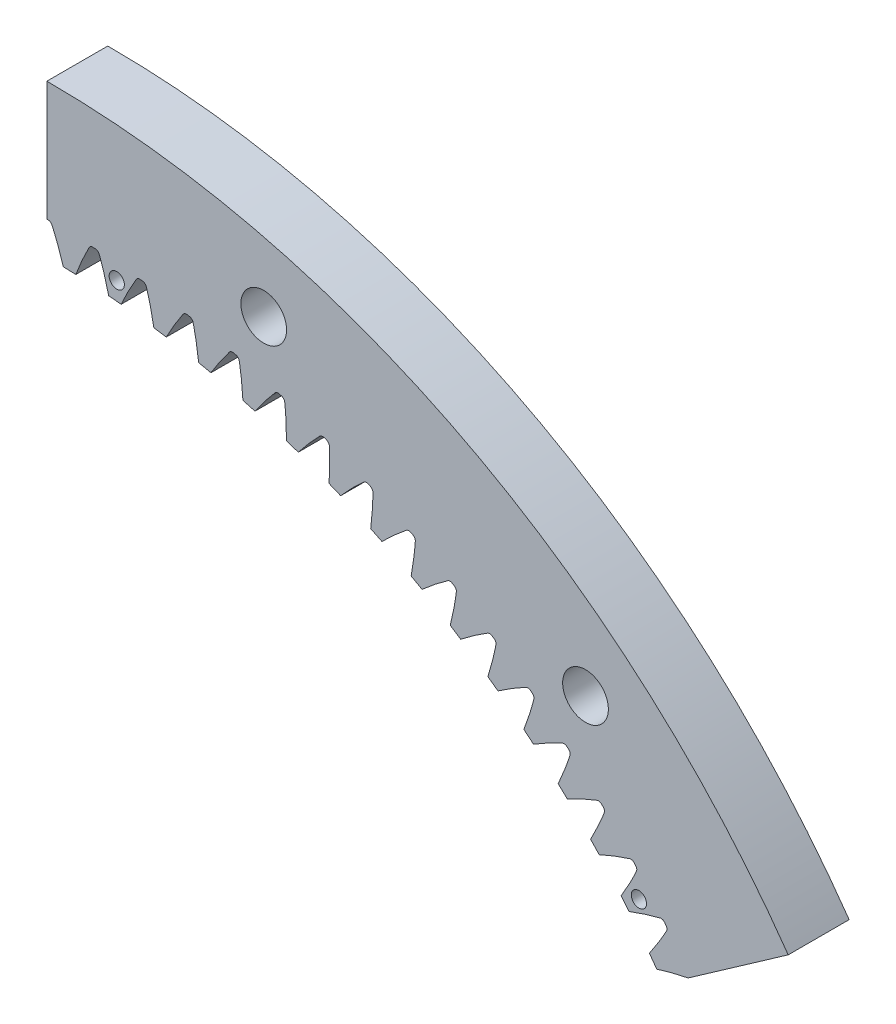
from build123d import *

# Parameters (mm, degrees)
SKETCHREVOLVESPURASSEMBLYNEW2GEAR_W       = 4
SKETCHREVOLVESPURASSEMBLYNEW2GEAR_H       = 10
TOOTHEXTRUDECUTSPURASSEMBLYNEW2GEAR_DEPTH = 4
PATTERNSPURASSEMBLYNEW2GEAR_COUNT         = 104
SKETCH_1_R                                = 1.5
CUT_EXTRUDE_1_DEPTH                       = 85.098106785
SKETCH_2_R                                = 0.5
CUT_EXTRUDE_2_DEPTH                       = 1


with BuildPart() as part:
    # SketchRevolveSpurAssemblyNew2Gear → SpurAssemblyNew2Gear (revolve)
    with BuildSketch(Plane(origin=(0, 0, 0), x_dir=(0, 0, -1), z_dir=(1, 0, 0))):
        with Locations((2, 54.399038462)):
            Rectangle(SKETCHREVOLVESPURASSEMBLYNEW2GEAR_W, SKETCHREVOLVESPURASSEMBLYNEW2GEAR_H)
    revolve(axis=Axis((0, 0, 0), (0, 0, -1)))

    # SketchToothSpurAssemblyNew2Gear → ToothExtrudeCutSpurAssemblyNew2Gear (cut, symmetric)
    with BuildSketch(Plane.XY):
        with BuildLine():
            ThreePointArc((49.139463497, -1.153700519), (49.153004971, 0), (49.139463497, 1.153700519))
            add(Edge.make_bspline(
                [(49.139463497, 1.153700519), (49.286109569, 1.112375592), (49.510220487, 1.045389162), (49.813750924, 0.947309864), (50.055449758, 0.865152603), (50.305972537, 0.775805702), (50.565072037, 0.678785835), (50.832899739, 0.574601978), (51.108000952, 0.459863429), (51.309373521, 0.380423551), (51.427190703, 0.322446544), (51.461136128, 0.297293766), (51.491079607, 0.26803453), (51.516447876, 0.234674807), (51.536698627, 0.198013634), (51.556477606, 0.146135037), (51.563300975, 0.091574007), (51.562323517, 0.038492677), (51.562588241, 0), (51.562323517, -0.038492677), (51.563300975, -0.091574007), (51.556477606, -0.146135037), (51.536698627, -0.198013634), (51.516447876, -0.234674807), (51.491079607, -0.26803453), (51.461136128, -0.297293766), (51.427190703, -0.322446544), (51.309373521, -0.380423551), (51.108000952, -0.459863429), (50.832899739, -0.574601978), (50.565072037, -0.678785835), (50.305972537, -0.775805702), (50.055449758, -0.865152603), (49.813750924, -0.947309864), (49.510220487, -1.045389162), (49.286109569, -1.112375592), (49.139463497, -1.153700519)],
                knots=[0, 0, 0, 0, 0.081489338, 0.125094302, 0.170606129, 0.218024819, 0.267350371, 0.318582787, 0.371722066, 0.426768208, 0.434364679, 0.441808018, 0.449251357, 0.456694696, 0.464138034, 0.471581373, 0.486277069, 0.493138537, 0.5, 0.506861463, 0.513722931, 0.528418627, 0.535861966, 0.543305304, 0.550748643, 0.558191982, 0.565635321, 0.573231792, 0.628277934, 0.681417213, 0.732649629, 0.781975181, 0.829393871, 0.874905698, 0.918510662, 1, 1, 1, 1], degree=3))
        make_face()
    toothextrudecutspurassemblynew2gear = extrude(amount=TOOTHEXTRUDECUTSPURASSEMBLYNEW2GEAR_DEPTH, both=True, mode=Mode.SUBTRACT)

    # PatternSpurAssemblyNew2Gear: ToothExtrudeCutSpurAssemblyNew2Gear ×104 about axis
    patternspurassemblynew2gear_axis = Axis((0, 0, 50), (0, 0, -1))
    for i in range(1, PATTERNSPURASSEMBLYNEW2GEAR_COUNT):
        add(toothextrudecutspurassemblynew2gear.rotate(patternspurassemblynew2gear_axis, i * 360 / PATTERNSPURASSEMBLYNEW2GEAR_COUNT), mode=Mode.SUBTRACT)

    # Эскиз1 → Вырез-Вытянуть1 (cut, through all)
    with BuildSketch(Plane.XY):
        with Locations((14.235047481, 53.125920446)):
            Circle(SKETCH_1_R)
        with Locations((35.353318533, 42.132444372)):
            Circle(SKETCH_1_R)
        with BuildLine():
            Line((0, 0), (0, 72.303537868))
            ThreePointArc((0, 72.303537868), (-33.386058343, -64.134021366), (59.227590854, 41.471605586))
            Line((59.227590854, 41.471605586), (0, 0))
        make_face()
    extrude(amount=-CUT_EXTRUDE_1_DEPTH, mode=Mode.SUBTRACT)

    # Эскиз2 → Вырез-Вытянуть2 (cut)
    with BuildSketch(Plane.XY):
        with Locations((38.856919853, 32.328973038)):
            Circle(SKETCH_2_R)
        with Locations((4.589283721, 50.375129486)):
            Circle(SKETCH_2_R)
    extrude(amount=-CUT_EXTRUDE_2_DEPTH, mode=Mode.SUBTRACT)


solid = part.part
